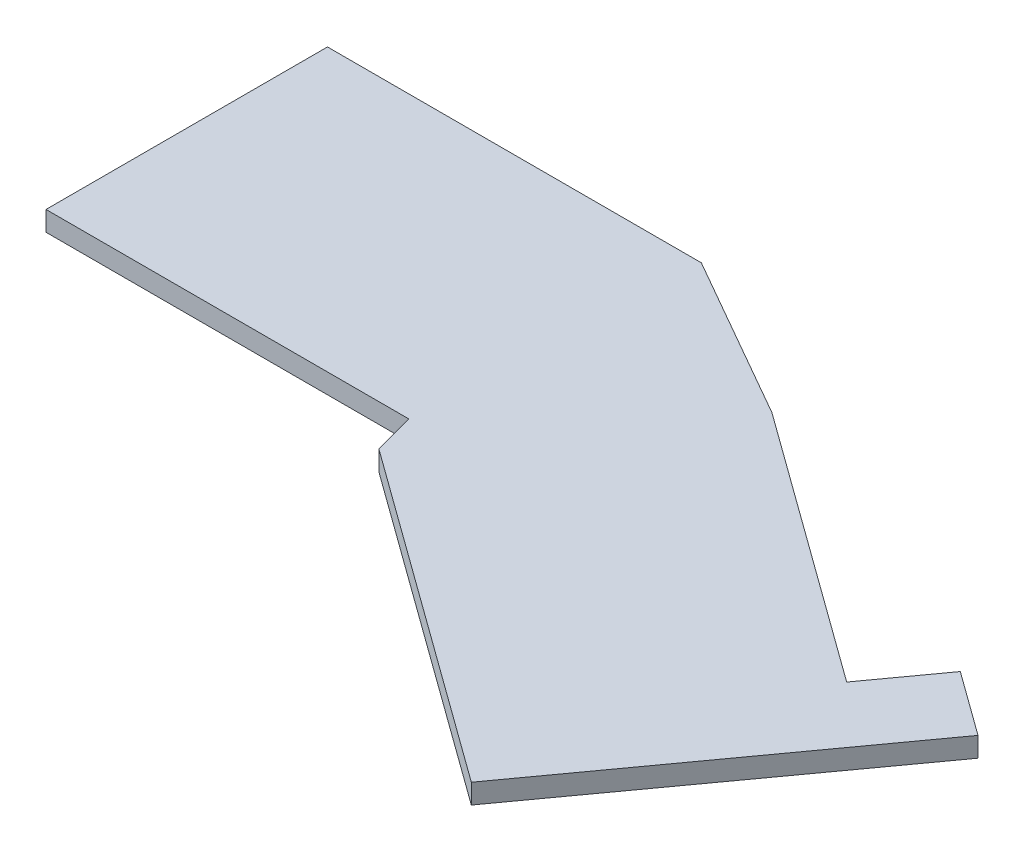
from build123d import *

# Parameters (mm, degrees)
EXTRUDE_1_DEPTH = 2
EXTRUDE_2_DEPTH = 2.5


with BuildPart() as part:
    # 草图1 → 凸台-拉伸1 (new body)
    with BuildSketch(Plane(origin=(0, 0, 0), x_dir=(1, 0, 0), z_dir=(0, 1, 0))):
        Polygon((-1.25, 32), (-1.25, -32), (81.25, -32), (83.75, -41.313840204), (159.893914202, -96.432841737), (208.269633633, -29.6044064), (193.688884105, -19.049703979), (182.840995505, -34.035474327), (121.277830831, 10.528824785), (83.75, 32), align=None)
        Polygon((0, 30.75), (0, -30.75), (82.208724754, -30.75), (84.842274477, -40.561384515), (159.614327597, -94.687324241), (206.524116136, -29.883993005), (193.968470709, -20.795221475), (183.12058211, -35.780991824), (120.599033271, 9.477061724), (83.417685679, 30.75), align=None, mode=Mode.SUBTRACT)
    extrude(amount=-EXTRUDE_1_DEPTH)

    # 草图2 → 凸台-拉伸2 (add)
    with BuildSketch(Plane(origin=(0, 0, 0), x_dir=(1, 0, 0), z_dir=(0, 1, 0))):
        Polygon((-1.25, 32), (-1.25, -32), (81.25, -32), (83.75, -41.313840204), (159.893914202, -96.432841737), (208.269633633, -29.6044064), (193.688884105, -19.049703979), (182.840995505, -34.035474327), (121.277830831, 10.528824785), (83.75, 32), align=None)
    extrude(amount=EXTRUDE_2_DEPTH)


solid = part.part
